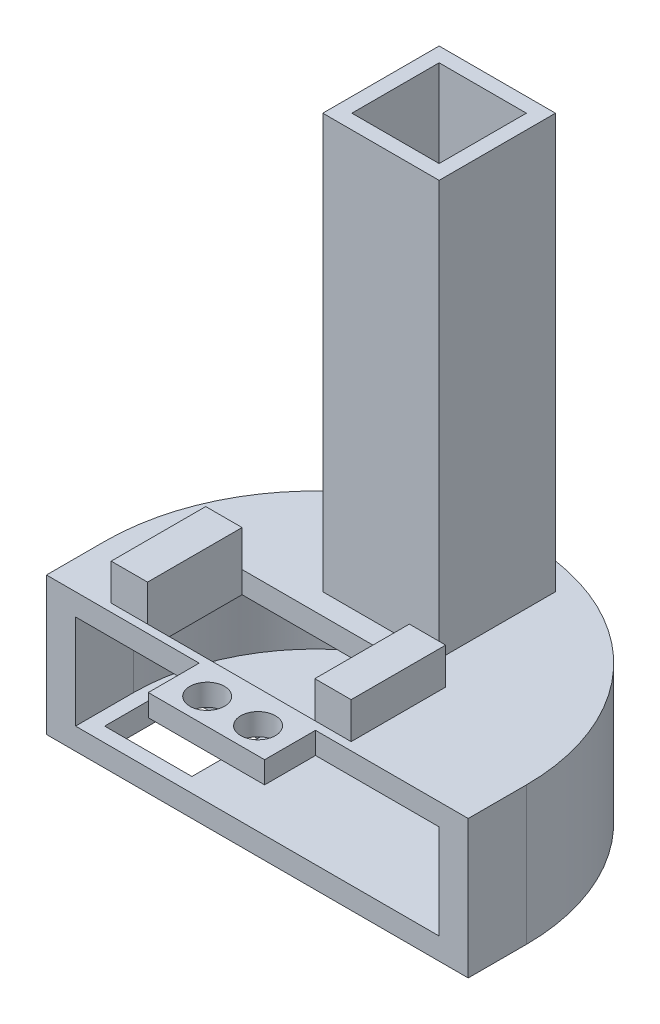
from build123d import *

# Parameters (mm, degrees)
BOSS_EXTRUDE1_DEPTH = 16
SKETCH2_5_W         = 12
SKETCH2_5_H         = 12
BOSS_EXTRUDE2_DEPTH = 3
SKETCH3_W           = 23
SKETCH3_H           = 13
SKETCH3_W_2         = 12
SKETCH3_H_2         = 12
SKETCH3_R           = 2.38125
BOSS_EXTRUDE3_DEPTH = 3
SKETCH3_4_W         = 16
SKETCH3_4_H         = 16
SKETCH3_4_W_2       = 12
SKETCH3_4_H_2       = 12
BOSS_EXTRUDE4_DEPTH = 60
SKETCH3_5_W         = 5
SKETCH3_5_H         = 13
BOSS_EXTRUDE5_DEPTH = 8


with BuildPart() as part:
    # Sketch2 → Boss-Extrude1 (new body)
    with BuildSketch(Plane(origin=(0, 0, 0), x_dir=(1, 0, 0), z_dir=(0, 1, 0))):
        with BuildLine():
            Line((25, 8), (25, 0))
            Line((25, 0), (29, 0))
            Line((29, 0), (29, 8))
            ThreePointArc((29, 8), (0, 37), (-29, 8))
            Line((-29, 8), (-29, 0))
            Line((-29, 0), (-25, 0))
            Line((-25, 0), (-25, 8))
            ThreePointArc((-25, 8), (0, 33), (25, 8))
        make_face()
    extrude(amount=BOSS_EXTRUDE1_DEPTH)

    # Sketch2<5> → Boss-Extrude2 (add)
    with BuildSketch(Plane(origin=(0, 0, 0), x_dir=(1, 0, 0), z_dir=(0, 1, 0))):
        with BuildLine():
            Line((-25, 0), (25, 0))
            Line((25, 0), (25, 8))
            ThreePointArc((25, 8), (0, 33), (-25, 8))
            Line((-25, 8), (-25, 0))
        make_face()
        with Locations((-17, 8)):
            Rectangle(SKETCH2_5_W, SKETCH2_5_H, mode=Mode.SUBTRACT)
    extrude(amount=BOSS_EXTRUDE2_DEPTH)

    # Sketch3 → Boss-Extrude3 (add)
    with BuildSketch(Plane(origin=(0, 16, 0), x_dir=(1, 0, 0), z_dir=(0, 1, 0))):
        with BuildLine():
            Line((-29, 8), (-29, 0))
            Line((-29, 0), (-8, 0))
            Line((-8, 0), (-8, -7))
            Line((-8, -7), (8, -7))
            Line((8, -7), (8, 0))
            Line((8, 0), (29, 0))
            Line((29, 0), (29, 8))
            ThreePointArc((29, 8), (0, 37), (-29, 8))
        make_face()
        with Locations((-4.7, 7.6)):
            Rectangle(SKETCH3_W, SKETCH3_H, mode=Mode.SUBTRACT)
        with Locations((0, 25)):
            Rectangle(SKETCH3_W_2, SKETCH3_H_2, mode=Mode.SUBTRACT)
        with Locations((3.5, -3.4)):
            Circle(SKETCH3_R, mode=Mode.SUBTRACT)
        with Locations((-3.5, -3.4)):
            Circle(SKETCH3_R, mode=Mode.SUBTRACT)
    extrude(amount=BOSS_EXTRUDE3_DEPTH)

    # Sketch3<4> → Boss-Extrude4 (add)
    with BuildSketch(Plane(origin=(0, 16, 0), x_dir=(1, 0, 0), z_dir=(0, 1, 0))):
        with Locations((0, 25)):
            Rectangle(SKETCH3_4_W, SKETCH3_4_H)
        with Locations((0, 25)):
            Rectangle(SKETCH3_4_W_2, SKETCH3_4_H_2, mode=Mode.SUBTRACT)
    extrude(amount=BOSS_EXTRUDE4_DEPTH)

    # Sketch3<5> → Boss-Extrude5 (add)
    with BuildSketch(Plane(origin=(0, 16, 0), x_dir=(1, 0, 0), z_dir=(0, 1, 0))):
        with Locations((-18.7, 7.6)):
            Rectangle(SKETCH3_5_W, SKETCH3_5_H)
        Polygon((9, 14.1), (6.8, 14.1), (6.8, 1.1), (11.8, 1.1), (11.8, 14.1), align=None)
    extrude(amount=BOSS_EXTRUDE5_DEPTH)


solid = part.part
